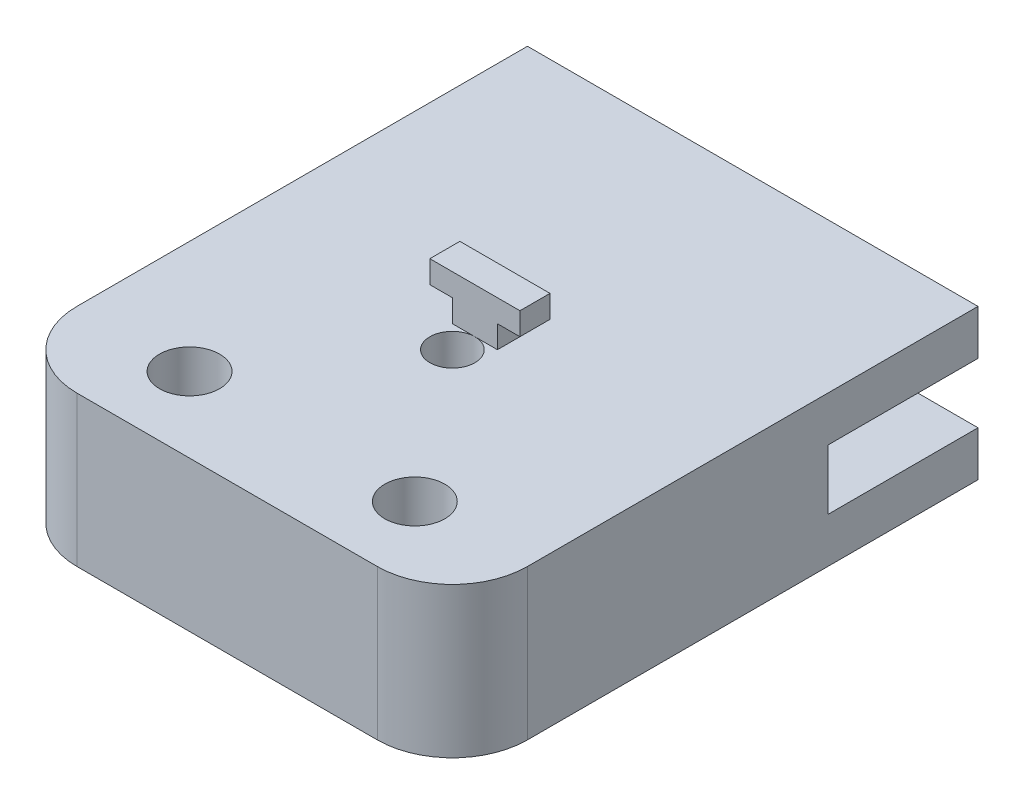
from build123d import *

# Parameters (mm, degrees)
CROQUIS1_W              = 30
CROQUIS1_H              = 35
CROQUIS1_R              = 2
SALIENTE_EXTRUIR1_DEPTH = 10
CROQUIS2_W              = 10
CROQUIS2_H              = 4
CORTAR_EXTRUIR1_DEPTH   = 41
REDONDEO1_R             = 5
CROQUIS3_R              = 1.5
CORTAR_EXTRUIR2_DEPTH   = 10
CROQUIS4_W              = 6
CROQUIS4_H              = 2
SALIENTE_EXTRUIR2_DEPTH = 3
CROQUIS5_W              = 1.5
CROQUIS5_H              = 1.5
CORTAR_EXTRUIR3_DEPTH   = 3


with BuildPart() as part:
    # Croquis1 → Saliente-Extruir1 (new body)
    with BuildSketch(Plane(origin=(0, 0, 0), x_dir=(1, 0, 0), z_dir=(0, 1, 0))):
        with Locations((15, 17.5)):
            Rectangle(CROQUIS1_W, CROQUIS1_H)
        with Locations(Location((7.5, 5, 0), (0, 0, 270))):
            Circle(CROQUIS1_R, mode=Mode.SUBTRACT)
        with Locations(Location((22.5, 5, 0), (0, 0, 270))):
            Circle(CROQUIS1_R, mode=Mode.SUBTRACT)
    extrude(amount=SALIENTE_EXTRUIR1_DEPTH)

    # Croquis2 → Cortar-Extruir1 (cut)
    with BuildSketch(Plane(origin=(30, 0, 0), x_dir=(0, 0, -1), z_dir=(1, 0, 0))):
        with Locations((30, 5)):
            Rectangle(CROQUIS2_W, CROQUIS2_H)
    extrude(amount=-CORTAR_EXTRUIR1_DEPTH, mode=Mode.SUBTRACT)

    # Redondeo1
    redondeo1_edges = [part.edges().sort_by_distance(p)[0] for p in [
        (30, 5, 0),
        (0, 5, 0),
    ]]
    fillet(redondeo1_edges, radius=REDONDEO1_R)

    # Croquis3 → Cortar-Extruir2 (cut)
    with BuildSketch(Plane(origin=(0, 10, 0), x_dir=(1, 0, 0), z_dir=(0, 1, 0))):
        with Locations(Location((15, 15, 0), (0, 0, 270))):
            Circle(CROQUIS3_R)
    extrude(amount=-CORTAR_EXTRUIR2_DEPTH, mode=Mode.SUBTRACT)

    # Croquis4 → Saliente-Extruir2 (add)
    with BuildSketch(Plane(origin=(0, 10, 0), x_dir=(1, 0, 0), z_dir=(0, 1, 0))):
        with Locations((15, 17.5)):
            Rectangle(CROQUIS4_W, CROQUIS4_H)
    extrude(amount=SALIENTE_EXTRUIR2_DEPTH)

    # Croquis5 → Cortar-Extruir3 (cut)
    with BuildSketch(Plane.XY.offset(-16.5)):
        with Locations((17.25, 10.75)):
            Rectangle(CROQUIS5_W, CROQUIS5_H)
        with Locations((12.75, 10.75)):
            Rectangle(CROQUIS5_W, CROQUIS5_H)
    extrude(amount=-CORTAR_EXTRUIR3_DEPTH, mode=Mode.SUBTRACT)


solid = part.part
